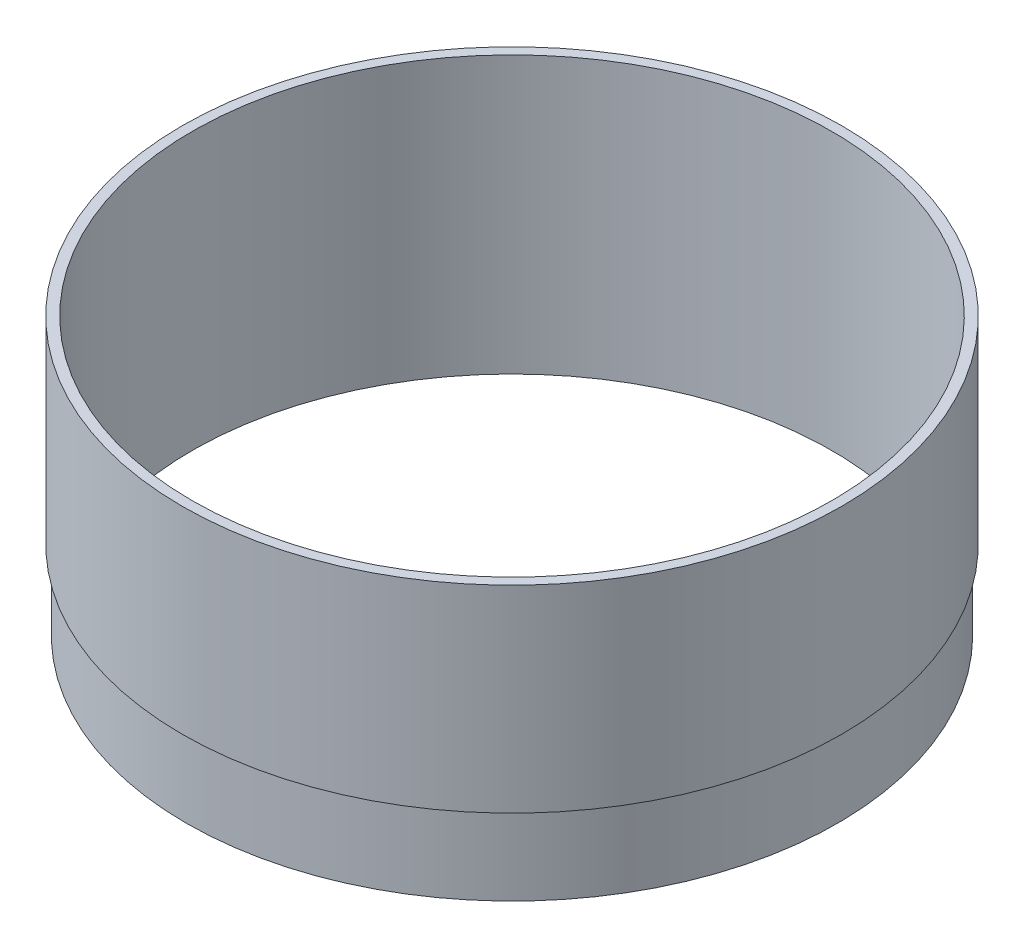
from build123d import *

# Parameters (mm, degrees)
SKETCH2_R           = 16.5
SKETCH2_R_2         = 16.2
BOSS_EXTRUDE1_DEPTH = 4
SKETCH3_R           = 16.7
SKETCH3_R_2         = 16.2
BOSS_EXTRUDE2_DEPTH = 10


with BuildPart() as part:
    # Sketch2 → Boss-Extrude1 (new body)
    with BuildSketch(Plane(origin=(0, 0, 0), x_dir=(1, 0, 0), z_dir=(0, 1, 0))):
        with Locations(Location((0, 0, 0), (0, 0, 270))):
            Circle(SKETCH2_R)
        with Locations(Location((0, 0, 0), (0, 0, 270))):
            Circle(SKETCH2_R_2, mode=Mode.SUBTRACT)
    extrude(amount=BOSS_EXTRUDE1_DEPTH)

    # Sketch3 → Boss-Extrude2 (add)
    with BuildSketch(Plane(origin=(0, 4, 0), x_dir=(1, 0, 0), z_dir=(0, 1, 0))):
        with Locations(Location((0, 0, 0), (0, 0, 270))):
            Circle(SKETCH3_R)
        with Locations(Location((0, 0, 0), (0, 0, 270))):
            Circle(SKETCH3_R_2, mode=Mode.SUBTRACT)
    extrude(amount=BOSS_EXTRUDE2_DEPTH)


solid = part.part
